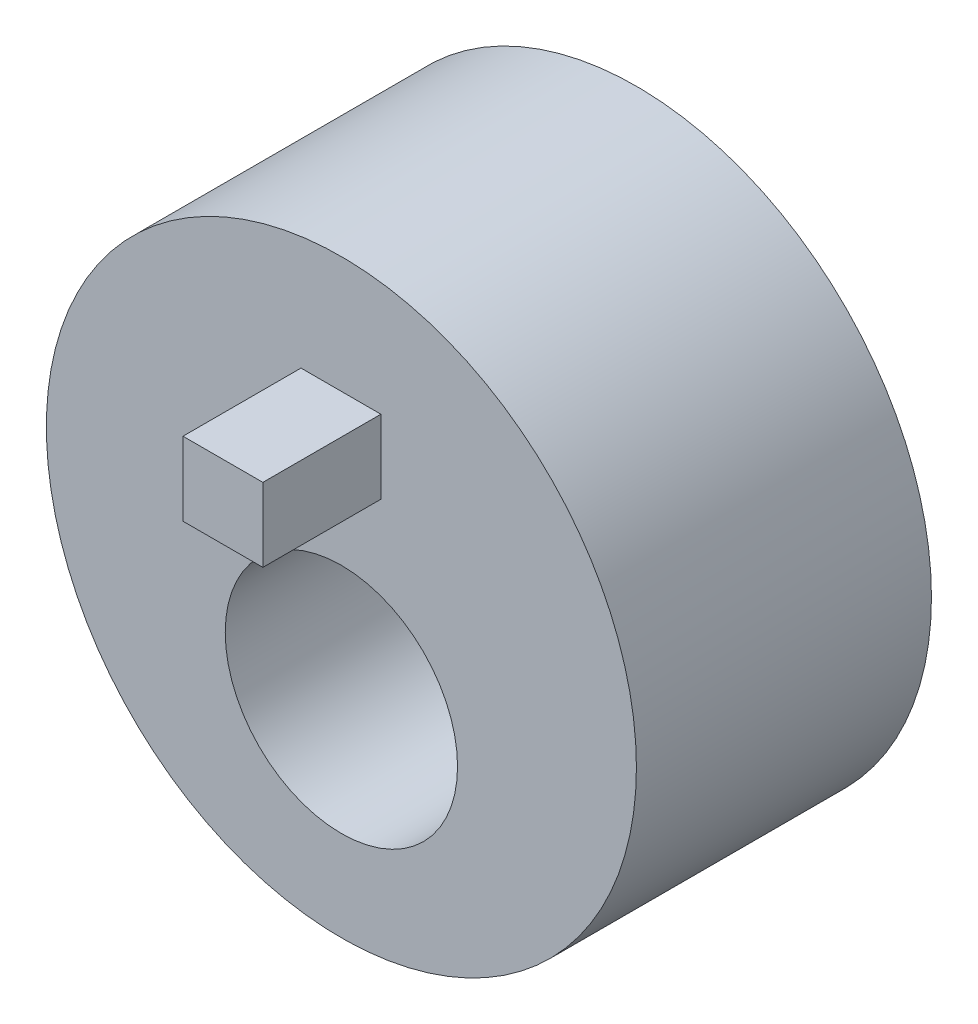
from build123d import *

# Parameters (mm, degrees)
SKETCH1_R           = 6.35
SKETCH1_R_2         = 2.499995
BOSS_EXTRUDE1_DEPTH = 6.35
SKETCH2_W           = 1.71989263
SKETCH2_H           = 1.584620177
BOSS_EXTRUDE2_DEPTH = 2.54


with BuildPart() as part:
    # Sketch1 → Boss-Extrude1 (new body)
    with BuildSketch(Plane.XY):
        Circle(SKETCH1_R)
        with Locations((0, -1.905)):
            Circle(SKETCH1_R_2, mode=Mode.SUBTRACT)
    extrude(amount=BOSS_EXTRUDE1_DEPTH)

    # Sketch2 → Boss-Extrude2 (add)
    with BuildSketch(Plane.XY.offset(6.35)):
        with Locations((-0.009662318, 3.043630217)):
            Rectangle(SKETCH2_W, SKETCH2_H)
    extrude(amount=BOSS_EXTRUDE2_DEPTH)


solid = part.part
